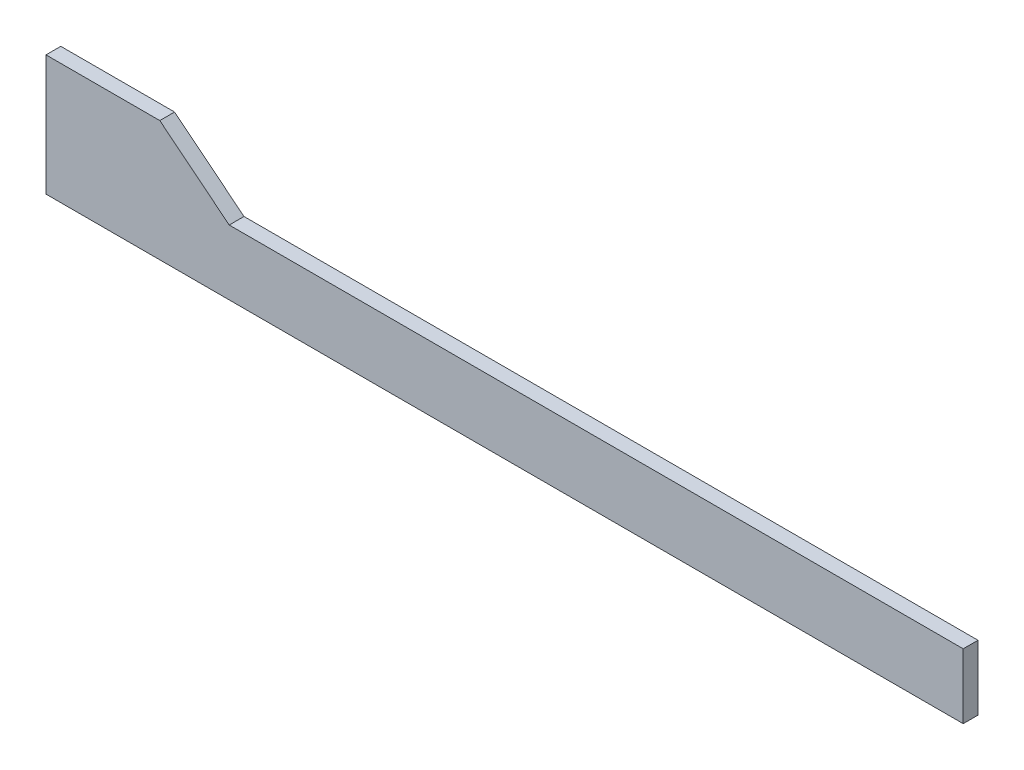
from build123d import *

# Parameters (mm, degrees)
SALIENTE_EXTRUIR1_DEPTH = 13


with BuildPart() as part:
    # Croquis1 → Saliente-Extruir1 (new body)
    with BuildSketch(Plane.XY):
        Polygon((-403, 53), (-403, -53), (403, -53), (403, 4), (-242, 4), (-303, 53), align=None)
    extrude(amount=SALIENTE_EXTRUIR1_DEPTH)


solid = part.part
